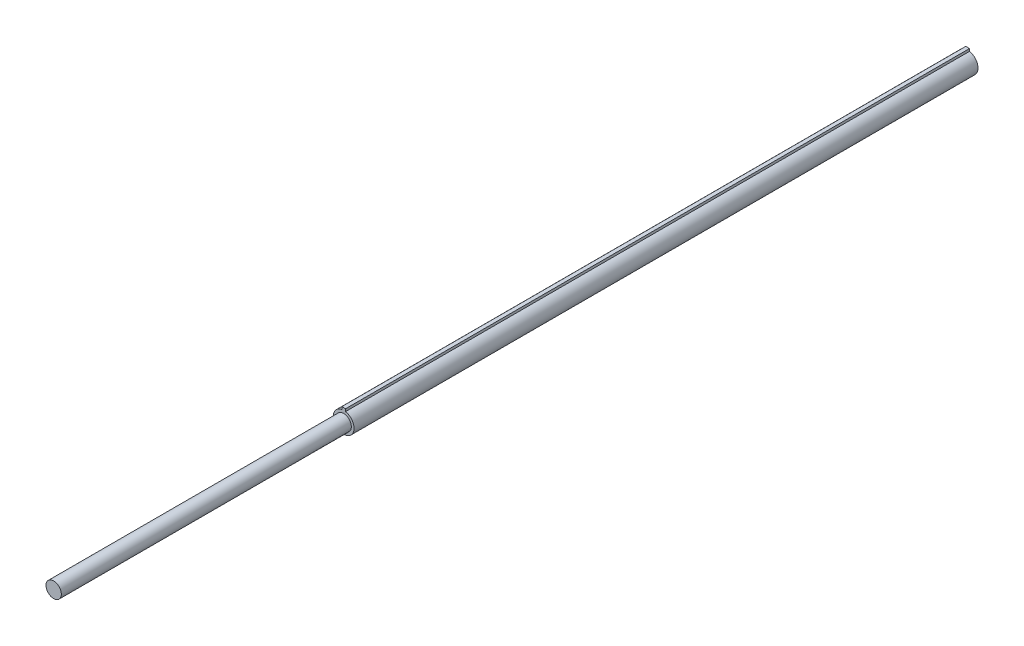
from build123d import *

# Parameters (mm, degrees)
SALIENTE_EXTRUIR1_DEPTH = 150.6
CROQUIS2_R              = 1.85
SALIENTE_EXTRUIR2_DEPTH = 70


with BuildPart() as part:
    # Croquis1 → Saliente-Extruir1 (new body)
    with BuildSketch(Plane.XY):
        with BuildLine():
            Line((-78.077598734, 121.298692457), (-78.077598734, 121.898692457))
            Line((-78.077598734, 121.898692457), (-77.177598734, 121.898692457))
            Line((-77.177598734, 121.898692457), (-77.177598734, 121.298692457))
            ThreePointArc((-77.177598734, 121.298692457), (-77.627598734, 116.339525931), (-78.077598734, 121.298692457))
        make_face()
    extrude(amount=SALIENTE_EXTRUIR1_DEPTH)

    # Croquis2 → Saliente-Extruir2 (add)
    with BuildSketch(Plane.XY.offset(150.6)):
        with Locations((-77.627598734, 118.839525931)):
            Circle(CROQUIS2_R)
    extrude(amount=SALIENTE_EXTRUIR2_DEPTH)


solid = part.part
